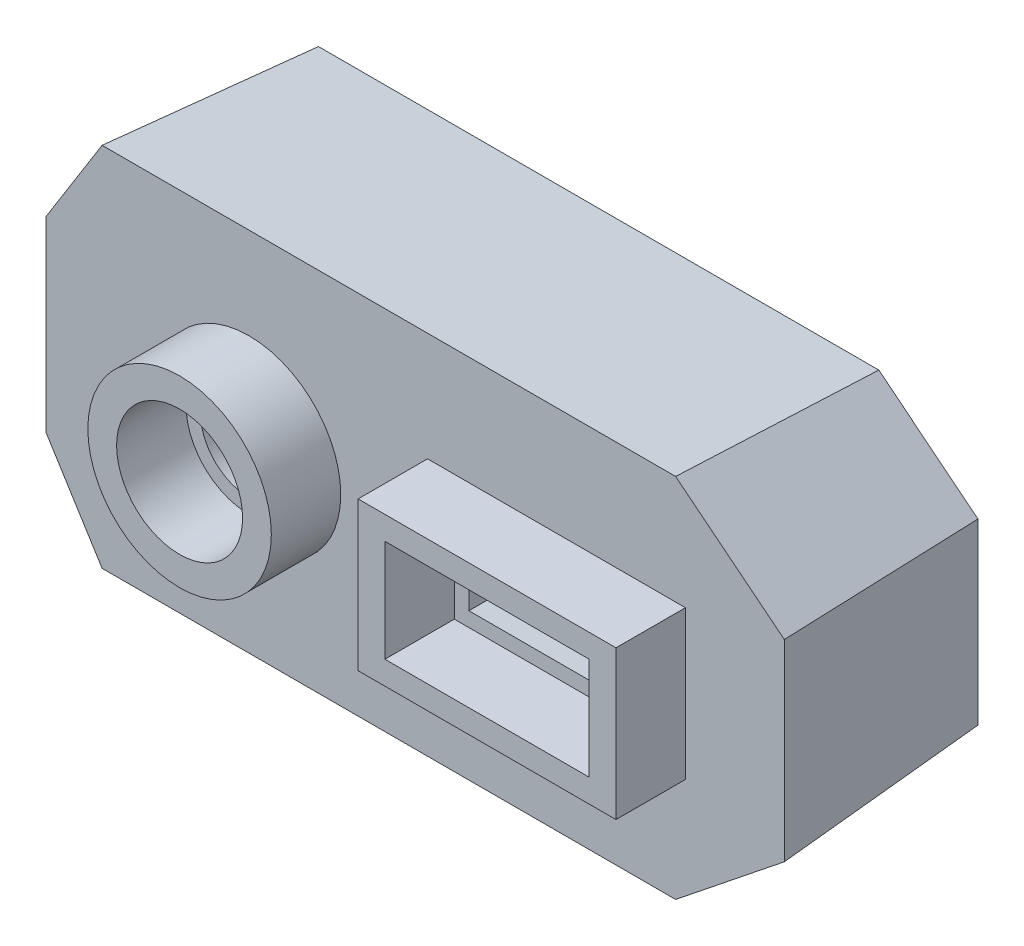
from build123d import *

# Parameters (mm, degrees)
SKETCH1_R           = 12.7
SKETCH1_W           = 41.2
SKETCH1_H           = 20.6
BOSS_EXTRUDE1_DEPTH = 42
BOSS_EXTRUDE1_DRAFT = -4
SKETCH2_R           = 18.5
SKETCH2_R_2         = 12.7
SKETCH2_W           = 52
SKETCH2_H           = 30
SKETCH2_W_2         = 41.2
SKETCH2_H_2         = 20.6
BOSS_EXTRUDE2_DEPTH = 56


with BuildPart() as part:
    # Sketch1 → Boss-Extrude1 (with draft: the straight prism first)
    with BuildSketch(Plane.XY):
        Polygon((-28, 34), (-38, 18), (-38, -18), (-28, -34), (85, -34), (105, -18), (105, 18), (85, 34), align=None)
        Circle(SKETCH1_R, mode=Mode.SUBTRACT)
        with Locations((62, 0)):
            Rectangle(SKETCH1_W, SKETCH1_H, mode=Mode.SUBTRACT)
    extrude(amount=BOSS_EXTRUDE1_DEPTH)
    # Boss-Extrude1: the draft: its side faces are tilted about the plane it starts from
    boss_extrude1_sides = [part.faces().sort_by_distance(p)[0] for p in [
        (-33, 26, 21),
        (-38, 0, 21),
        (-33, -26, 21),
        (28.5, -34, 21),
        (95, -26, 21),
        (105, 0, 21),
        (95, 26, 21),
        (28.5, 34, 21),
        (-12.7, 0, 21),
        (41.4, 0, 21),
        (62, 10.3, 21),
        (82.6, 0, 21),
        (62, -10.3, 21),
    ]]
    draft(boss_extrude1_sides, Plane.XY, BOSS_EXTRUDE1_DRAFT)

    # Sketch2 → Boss-Extrude2 (add)
    # profile 1 of 2: a face of its own
    with BuildSketch(Plane.XY):
        with Locations(Location((0, 0, 0), (0, 0, 180))):
            Circle(SKETCH2_R)
        with Locations(Location((0, 0, 0), (0, 0, 180))):
            Circle(SKETCH2_R_2, mode=Mode.SUBTRACT)
    # profile 2 of 2: a face of its own
    with BuildSketch(Plane.XY):
        with Locations((62, 0)):
            Rectangle(SKETCH2_W, SKETCH2_H)
        with Locations((62, 0)):
            Rectangle(SKETCH2_W_2, SKETCH2_H_2, mode=Mode.SUBTRACT)
    extrude(amount=BOSS_EXTRUDE2_DEPTH)


solid = part.part
